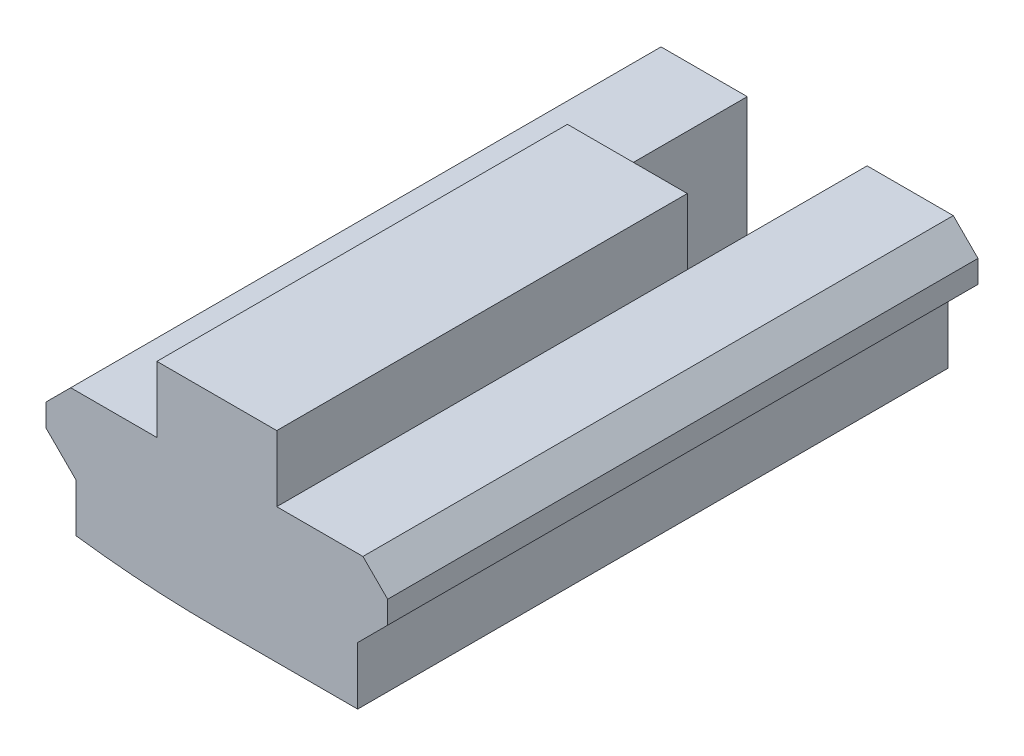
from build123d import *

# Parameters (mm, degrees)
BOSS_EXTRUDE1_DEPTH     = 19.7
CUT_EXTRUDE1_DEPTH      = 128.410635349
CUT_EXTRUDE1_DEPTH_BACK = 128.410635349
SKETCH2_W               = 4
SKETCH2_H               = 6


with BuildPart() as part:
    # Sketch1 → Boss-Extrude1 (new body)
    with BuildSketch(Plane.XY):
        with BuildLine():
            Line((-115.3, 0), (-120, 0))
            ThreePointArc((-120, 0), (-122.355151556, 0.077929384), (-124.7, 0.311376618))
            Line((-124.7, 0.311376618), (-124.7, 1.924264069))
            Line((-124.7, 1.924264069), (-125.7, 2.924264069))
            Line((-125.7, 2.924264069), (-125.7, 3.675735931))
            Line((-125.7, 3.675735931), (-124.875735931, 4.5))
            Line((-124.875735931, 4.5), (-122, 4.5))
            Line((-122, 4.5), (-122, 6.7))
            Line((-122, 6.7), (-118, 6.7))
            Line((-118, 6.7), (-118, 4.5))
            Line((-118, 4.5), (-115.124264069, 4.5))
            Line((-115.124264069, 4.5), (-114.3, 3.675735931))
            Line((-114.3, 3.675735931), (-114.3, 2.924264069))
            Line((-114.3, 2.924264069), (-115.3, 1.924264069))
            Line((-115.3, 1.924264069), (-115.3, 0))
        make_face()
    extrude(amount=-BOSS_EXTRUDE1_DEPTH)

    # Sketch2 → Cut-Extrude1 (cut, two sides: drawn at the far end of the back side and taken through both)
    with BuildSketch(Plane(origin=(0, 6.7, 0), x_dir=(1, 0, 0), z_dir=(0, 1, 0)).offset(-CUT_EXTRUDE1_DEPTH_BACK)):
        with Locations((-120, 16.7)):
            Rectangle(SKETCH2_W, SKETCH2_H)
    extrude(amount=CUT_EXTRUDE1_DEPTH + CUT_EXTRUDE1_DEPTH_BACK, mode=Mode.SUBTRACT)


solid = part.part
